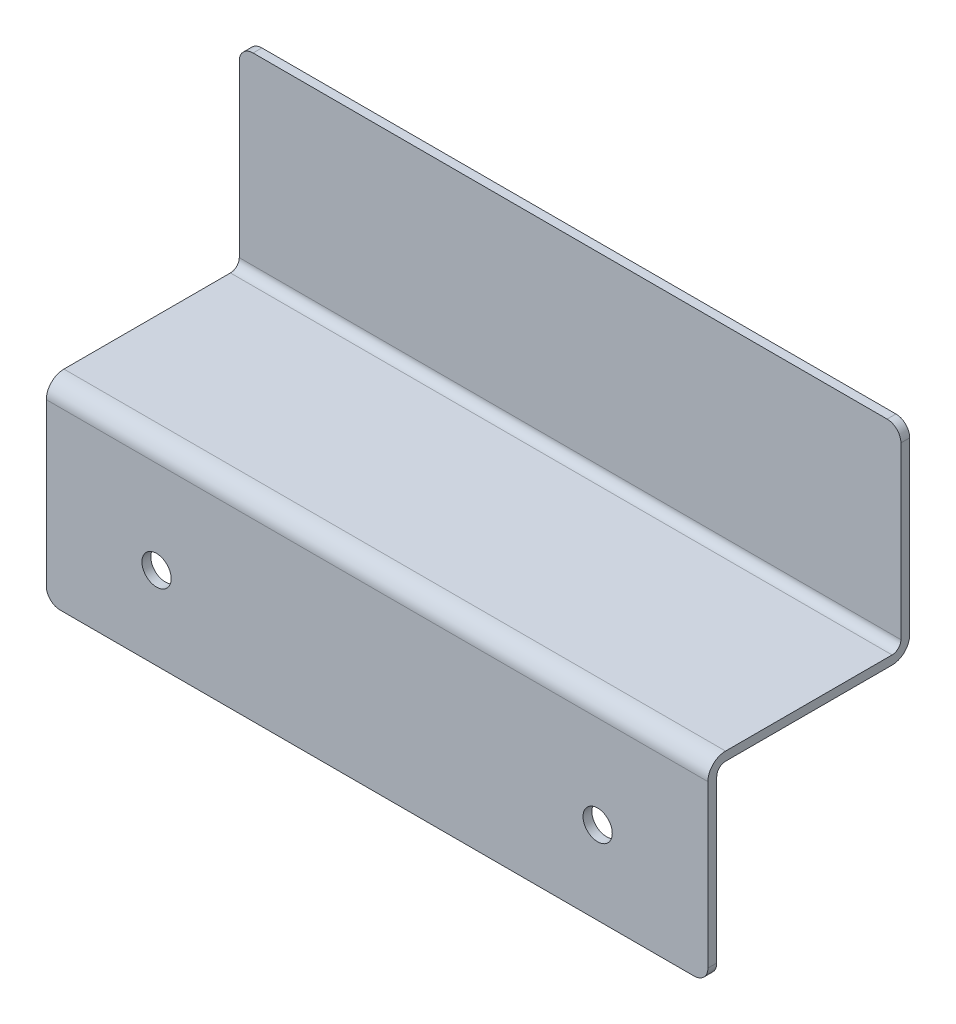
from build123d import *

# Parameters (mm, degrees)
BOSS_EXTRUDE1_DEPTH = 152.4
FILLET1_R           = 2.032
FILLET2_R           = 4.064
FILLET3_R           = 3.175
SKETCH2_R           = 3.3655
CUT_EXTRUDE1_DEPTH  = 183.454230765


with BuildPart() as part:
    # Sketch1 → Boss-Extrude1 (new body)
    with BuildSketch(Plane(origin=(0, 0, 0), x_dir=(0, 0, -1), z_dir=(1, 0, 0))):
        Polygon((0, 0), (0, -44.45), (-44.45, -44.45), (-44.45, -88.9), (-42.418, -88.9), (-42.418, -46.482), (2.032, -46.482), (2.032, 0), align=None)
    extrude(amount=BOSS_EXTRUDE1_DEPTH)

    # Fillet1
    fillet1_edges = [part.edges().sort_by_distance(p)[0] for p in [
        (76.2, -46.482, 42.418),
        (76.2, -44.45, 0),
    ]]
    fillet(fillet1_edges, radius=FILLET1_R)

    # Fillet2
    fillet2_edges = [part.edges().sort_by_distance(p)[0] for p in [
        (76.2, -46.482, -2.032),
        (76.2, -44.45, 44.45),
    ]]
    fillet(fillet2_edges, radius=FILLET2_R)

    # Fillet3
    fillet3_edges = [part.edges().sort_by_distance(p)[0] for p in [
        (0, 0, -1.016),
        (152.4, -88.9, 43.434),
        (152.4, 0, -1.016),
        (0, -88.9, 43.434),
    ]]
    fillet(fillet3_edges, radius=FILLET3_R)

    # Sketch2 → Cut-Extrude1 (cut, through all)
    with BuildSketch(Plane.XY.offset(44.45)):
        with Locations((25.4, -69.85)):
            Circle(SKETCH2_R)
        with Locations((127, -69.85)):
            Circle(SKETCH2_R)
    extrude(amount=-CUT_EXTRUDE1_DEPTH, mode=Mode.SUBTRACT)


solid = part.part
